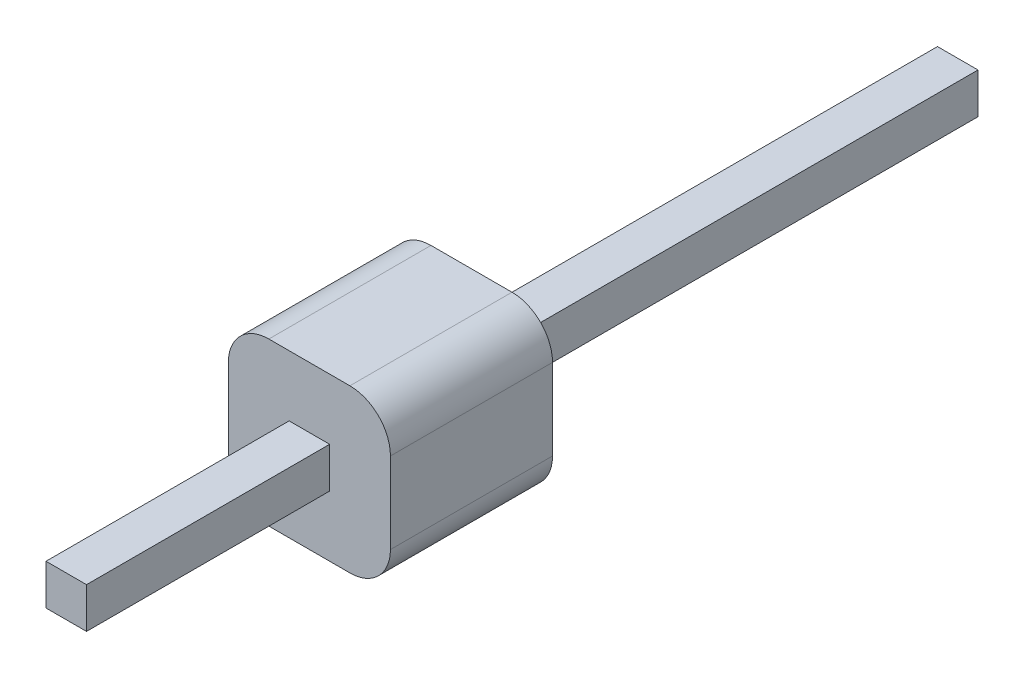
from build123d import *

# Parameters (mm, degrees)
SKETCH_1_W      = 2
SKETCH_1_H      = 2
EXTRUDE_1_DEPTH = 2
SKETCH_2_W      = 0.5
SKETCH_2_H      = 0.5
FILLET_1_R      = 0.5


with BuildPart() as part:
    # 草图1 → 拉伸1 (new body)
    with BuildSketch(Plane.XY):
        Rectangle(SKETCH_1_W, SKETCH_1_H)
    extrude(amount=EXTRUDE_1_DEPTH)

    # 扫描1: sweep along a path in 草图3
    with BuildLine(Plane(origin=(0, 0, 0), x_dir=(0, 0, -1), z_dir=(1, 0, 0))) as sweep_1_path:
        Line((-5, -0.28), (6, -0.28))
    # 草图2 → 扫描1 (sweep)
    with BuildSketch(Plane(origin=(0, 0, 5), x_dir=(-1, 0, 0), z_dir=(0, 0, -1))):
        Rectangle(SKETCH_2_W, SKETCH_2_H)
    sweep(path=sweep_1_path.line)

    # 圆角1
    fillet_1_edges = [part.edges().sort_by_distance(p)[0] for p in [
        (-1, 1, 1),
        (1, 1, 1),
        (1, -1, 1),
        (-1, -1, 1),
    ]]
    fillet(fillet_1_edges, radius=FILLET_1_R)


solid = part.part
